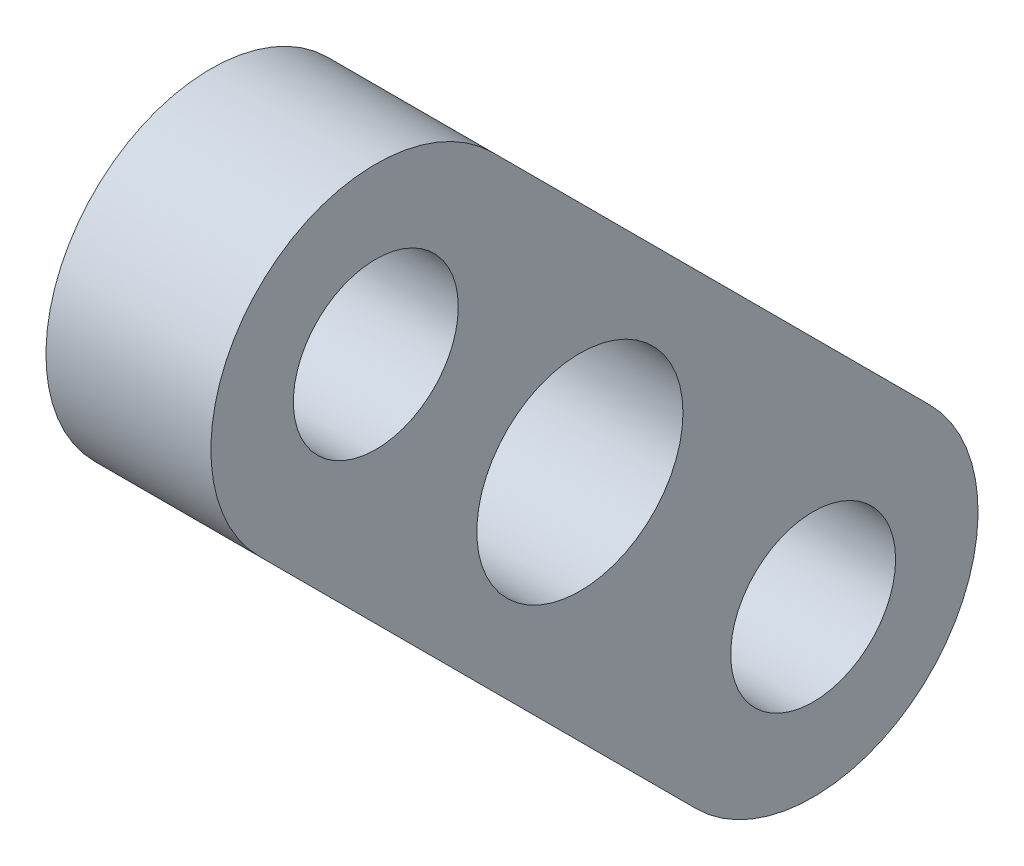
from build123d import *

# Parameters (mm, degrees)
SKETCH1_R           = 1
SKETCH1_R_2         = 1.25
BOSS_EXTRUDE1_DEPTH = 2


with BuildPart() as part:
    # Sketch1 → Boss-Extrude1 (new body)
    with BuildSketch(Plane(origin=(0, 0, 0), x_dir=(0, 0, -1), z_dir=(1, 0, 0))):
        with BuildLine():
            ThreePointArc((-1.060660172, 3.889087297), (-3.889087297, 3.889087297), (-3.889087297, 1.060660172))
            Line((-3.889087297, 1.060660172), (1.414213562, -4.242640687))
            ThreePointArc((1.414213562, -4.242640687), (4.242640687, -4.242640687), (4.242640687, -1.414213562))
            Line((4.242640687, -1.414213562), (-1.060660172, 3.889087297))
        make_face()
        with Locations((2.828427125, -2.828427125)):
            Circle(SKETCH1_R, mode=Mode.SUBTRACT)
        Circle(SKETCH1_R_2, mode=Mode.SUBTRACT)
        with Locations((-2.474873734, 2.474873734)):
            Circle(SKETCH1_R, mode=Mode.SUBTRACT)
    extrude(amount=BOSS_EXTRUDE1_DEPTH)


solid = part.part
